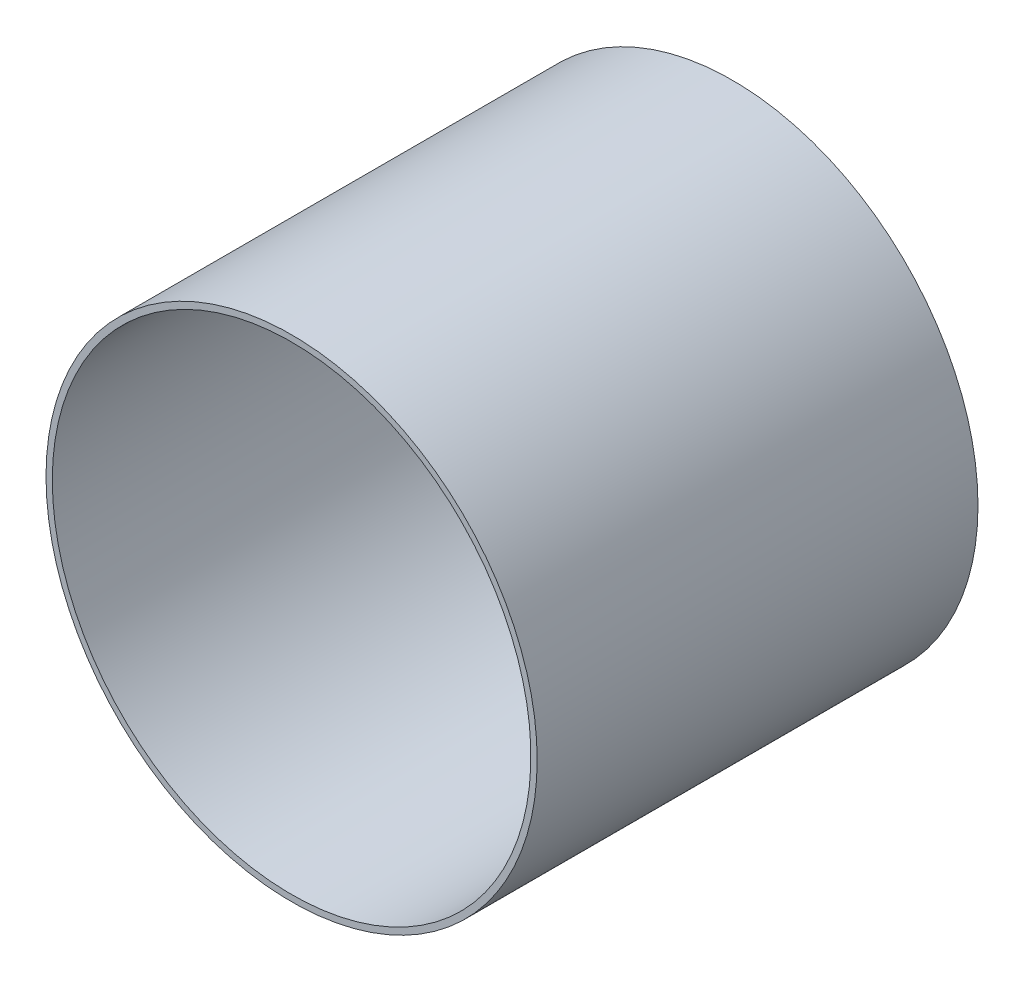
from build123d import *

# Parameters (mm, degrees)
EXTRUDE1_START = -35
SKETCH2_R      = 19.5
SKETCH2_R_2    = 19
EXTRUDE1_DEPTH = 35


with BuildPart() as part:
    # Sketch1 → Revolve1 (revolve)
    with BuildSketch(Plane(origin=(0, 0, 0), x_dir=(1, 0, 0), z_dir=(0, 1, 0))):
        Polygon((-72.838876034, 0), (-76.174491921, -3.812132442), (-76.174491921, -7.812132442), (-75.674491921, -7.812132442), (-75.674491921, -4), (-72.174491921, 0), align=None)
    revolve(axis=Axis((-57.174491921, 0, 0), (0, 0, 1)))

    # Sketch2 → Extrude1 (add)
    with BuildSketch(Plane(origin=(0, 0, 0), x_dir=(-1, 0, 0), z_dir=(0, 0, -1)).offset(EXTRUDE1_START)):
        with Locations((57.174491921, 0)):
            Circle(SKETCH2_R)
        with Locations((57.174491921, 0)):
            Circle(SKETCH2_R_2, mode=Mode.SUBTRACT)
    extrude(amount=EXTRUDE1_DEPTH)


solid = part.part
